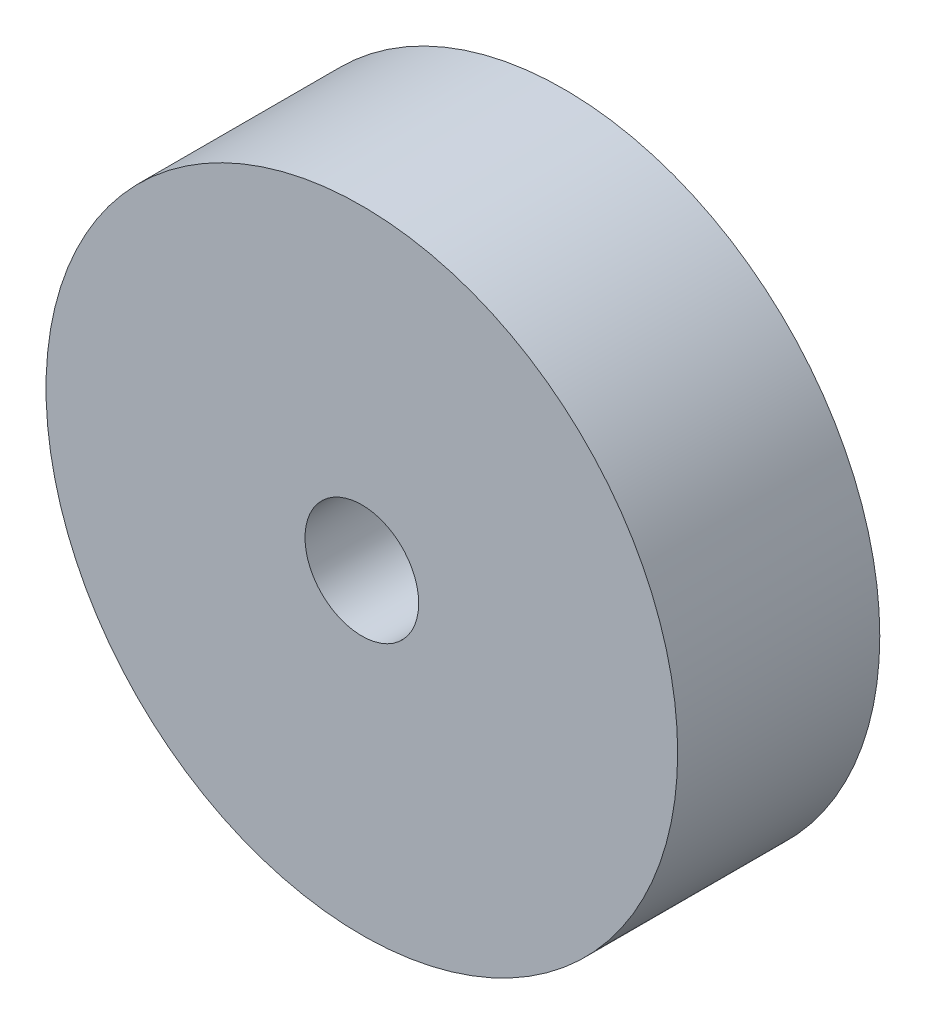
from build123d import *

# Parameters (mm, degrees)
ESQUISSE1_R        = 12.5
ESQUISSE1_R_2      = 2.25
BOSS_EXTRU_1_DEPTH = 8


with BuildPart() as part:
    # Esquisse1 → Boss.-Extru.1 (new body)
    with BuildSketch(Plane.XY):
        Circle(ESQUISSE1_R)
        Circle(ESQUISSE1_R_2, mode=Mode.SUBTRACT)
    extrude(amount=BOSS_EXTRU_1_DEPTH)


solid = part.part
